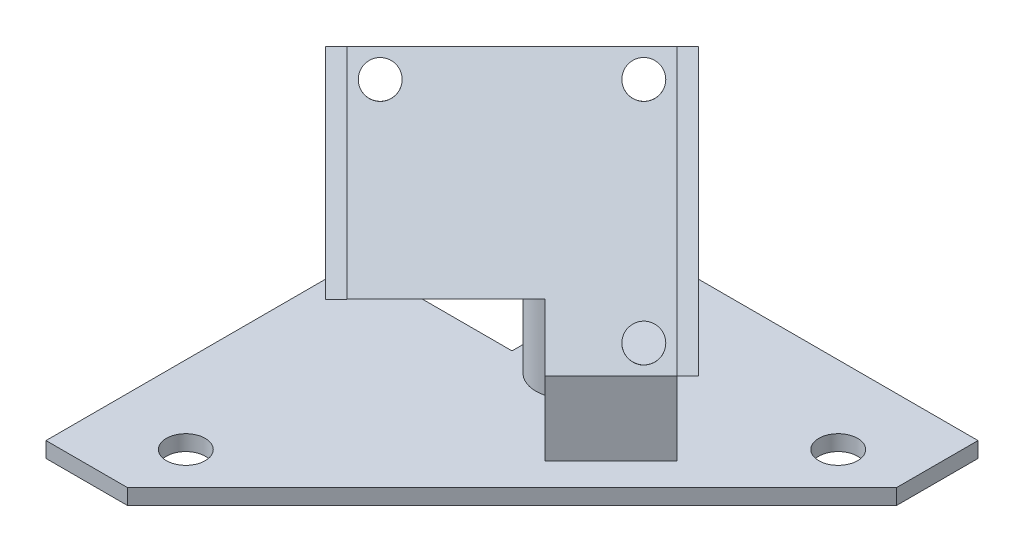
from build123d import *

# Parameters (mm, degrees)
SKETCH_1_R                  = 2.5
EXTRUDE_1_DEPTH             = 2
SKETCH_2_R                  = 2
EXTRUDE_3_DEPTH             = 2
EXTRUDE_4_REACH             = 93.431
SKETCH_4_R                  = 4
EXTRUDE_5_REACH             = 93.431
EXTRUDE_6_REACH             = 56.956
EXTRUDE_6_DIRECTION_2_DEPTH = 3


with BuildPart() as part:
    # 草图1 → 凸台-拉伸1 (new body)
    with BuildSketch(Plane(origin=(0, 0, 0), x_dir=(1, 0, 0), z_dir=(0, 1, 0))):
        Polygon((10.502525317, -60), (60, -10.502525317), (60, 0), (20, 0), (20, -20), (0, -20), (0, -60), align=None)
        with Locations(Location((10, -52, 0), (0, 0, 270))):
            Circle(SKETCH_1_R, mode=Mode.SUBTRACT)
        with Locations(Location((52, -10, 0), (0, 0, 270))):
            Circle(SKETCH_1_R, mode=Mode.SUBTRACT)
    extrude(amount=EXTRUDE_1_DEPTH)



with BuildPart() as body_2:
    # 草图2 → 凸台-拉伸3 (new body)
    with BuildSketch(Plane(origin=(24.318415307, 24.081140456, 24.318415307), x_dir=(-0.7071067811865475, 0, 0.7071067811865476), z_dir=(0.5792279653395701, 0.5735764363510444, 0.57922796533957))):
        Polygon((-3, 16.786030205), (-15, 16.786030205), (-15, -13.213969795), (15, -13.213969795), (15, 9.786030205), (-3, 9.786030205), align=None)
        with Locations(Location((-12, -10.213969795, 0), (0, 0, 180))):
            Circle(SKETCH_2_R, mode=Mode.SUBTRACT)
        with Locations(Location((12, -10.213969795, 0), (0, 0, 180))):
            Circle(SKETCH_2_R, mode=Mode.SUBTRACT)
        with Locations(Location((-12, 13.786030205, 0), (0, 0, 180))):
            Circle(SKETCH_2_R, mode=Mode.SUBTRACT)
    extrude(amount=EXTRUDE_3_DEPTH)


with BuildPart() as part_1:
    add(part.part)

    add(body_2.part)  # 凸台-拉伸4 merges body 2
    # 凸台-拉伸4: up to this plane
    extrude_4_end = Plane(origin=(24.318415307, 24.081140456, 24.318415307), z_dir=(0.5792279653395702, 0.5735764363510445, 0.5792279653395699))
    # 草图4 → 凸台-拉伸4 (add, up to the surface)
    with BuildSketch(Plane(origin=(0, 2, 0), x_dir=(1, 0, 0), z_dir=(0, 1, 0)), mode=Mode.PRIVATE) as extrude_4_sk1:
        with Locations(Location((26.030164055, -18.959096243, 0), (0, 0, 315))):
            Circle(SKETCH_4_R)
    extrude_4_tool1 = split(extrude(extrude_4_sk1.sketch, amount=EXTRUDE_4_REACH, mode=Mode.PRIVATE), bisect_by=extrude_4_end, keep=Keep.BOTH, mode=Mode.PRIVATE)
    add(extrude_4_tool1.solids().sort_by_distance((26.030164, 2, 18.959096))[0])

    # 草图5 → 凸台-拉伸5 (add, up to next)
    with BuildSketch(Plane(origin=(0, 2, 0), x_dir=(1, 0, 0), z_dir=(0, 1, 0)), mode=Mode.PRIVATE) as extrude_5_sk1:
        Polygon((41.733091591, -20.519888156), (33.247810217, -29.00516953), (34.406266148, -30.16362546), (42.891547522, -21.678344086), align=None)
    extrude_5_tool1 = extrude(extrude_5_sk1.sketch, amount=EXTRUDE_5_REACH, mode=Mode.PRIVATE) - part_1.part
    add(extrude_5_tool1.solids().sort_by_distance((38.069679, 2, 25.341757))[0])

    # 凸台-拉伸6: up to this face of the body (flat: up to its plane)
    extrude_6_end = Plane(part_1.part.faces().sort_by_distance((24.757422588, 23.562214363, 24.393270957))[0])
    # 草图6 → 凸台-拉伸6 (add, up to the picked face)
    with BuildSketch(Plane(origin=(25.476871238, 25.228293329, 25.476871238), x_dir=(0.45107473692648714, 0.36633593098762024, -0.8138363271408656), z_dir=(0.5792279653395701, 0.5735764363510444, 0.5792279653395701)), mode=Mode.PRIVATE) as extrude_6_sk1:
        Polygon((-7.506940922, 18.527137818), (-17.792853619, -2.044687575), (-19.581708001, -1.150260384), (-9.295795304, 19.421565009), align=None)
    extrude_6_tool1 = split(extrude(extrude_6_sk1.sketch, amount=-EXTRUDE_6_REACH, mode=Mode.PRIVATE), bisect_by=extrude_6_end, keep=Keep.BOTH, mode=Mode.PRIVATE)
    # 草图6 → 凸台-拉伸6 (add, up to the picked face)
    with BuildSketch(Plane(origin=(25.476871238, 25.228293329, 25.476871238), x_dir=(0.45107473692648714, 0.36633593098762024, -0.8138363271408656), z_dir=(0.5792279653395701, 0.5735764363510444, 0.5792279653395701)), mode=Mode.PRIVATE) as extrude_6_sk2:
        Polygon((19.325874808, 5.110729953), (5.909466943, -21.722085777), (7.698321325, -22.616512968), (21.11472919, 4.216302762), align=None)
    extrude_6_tool2 = split(extrude(extrude_6_sk2.sketch, amount=-EXTRUDE_6_REACH, mode=Mode.PRIVATE), bisect_by=extrude_6_end, keep=Keep.BOTH, mode=Mode.PRIVATE)
    add(extrude_6_tool1.solids().sort_by(Axis((13.468011, 26.632295, 36.095428), (-0.5792279653395701, -0.5735764363510444, -0.5792279653395701)))[0])
    add(extrude_6_tool2.solids().sort_by(Axis((37.514957, 23.765263, 14.88754), (-0.5792279653395701, -0.5735764363510444, -0.5792279653395701)))[0])

    # 草图6 → 凸台-拉伸6 direction 2 (add)
    with BuildSketch(Plane(origin=(25.476871238, 25.228293329, 25.476871238), x_dir=(0.45107473692648714, 0.36633593098762024, -0.8138363271408656), z_dir=(0.5792279653395701, 0.5735764363510444, 0.5792279653395701))):
        Polygon((-7.506940922, 18.527137818), (-17.792853619, -2.044687575), (-19.581708001, -1.150260384), (-9.295795304, 19.421565009), align=None)
        Polygon((19.325874808, 5.110729953), (5.909466943, -21.722085777), (7.698321325, -22.616512968), (21.11472919, 4.216302762), align=None)
    extrude(amount=EXTRUDE_6_DIRECTION_2_DEPTH)


solid = part_1.part
